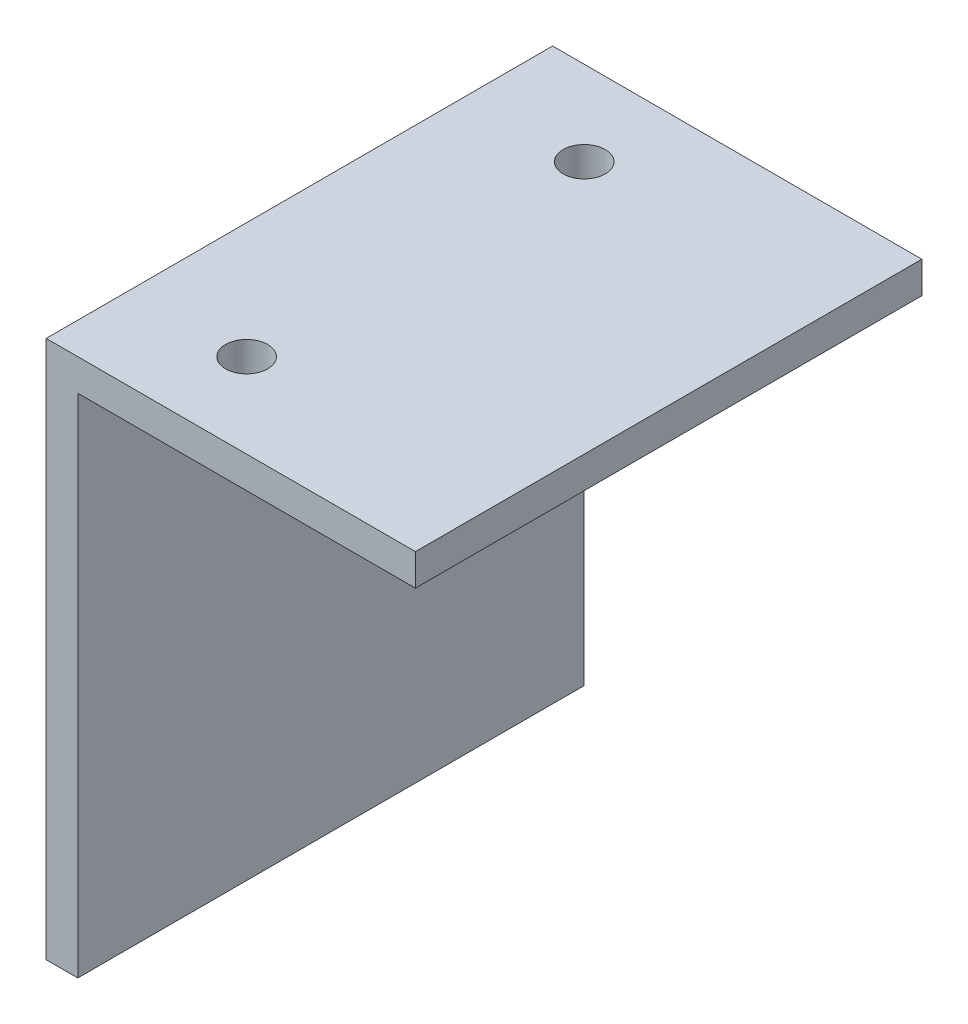
from build123d import *

# Parameters (mm, degrees)
SKETCH1_W           = 35
SKETCH1_H           = 48
SKETCH1_R           = 2
BOSS_EXTRUDE1_DEPTH = 3
SKETCH2_W           = 3
SKETCH2_H           = 48
BOSS_EXTRUDE2_DEPTH = 48


with BuildPart() as part:
    # Sketch1 → Boss-Extrude1 (new body)
    with BuildSketch(Plane(origin=(0, 0, 0), x_dir=(1, 0, 0), z_dir=(0, 1, 0))):
        Rectangle(SKETCH1_W, SKETCH1_H)
        with Locations(Location((-6.5, 16, 0), (0, 0, 270))):
            Circle(SKETCH1_R, mode=Mode.SUBTRACT)
        with Locations(Location((-6.5, -16, 0), (0, 0, 90))):
            Circle(SKETCH1_R, mode=Mode.SUBTRACT)
    extrude(amount=BOSS_EXTRUDE1_DEPTH)

    # Sketch2 → Boss-Extrude2 (add)
    with BuildSketch(Plane.XZ):
        with Locations((-16, 0)):
            Rectangle(SKETCH2_W, SKETCH2_H)
    extrude(amount=BOSS_EXTRUDE2_DEPTH)


solid = part.part
